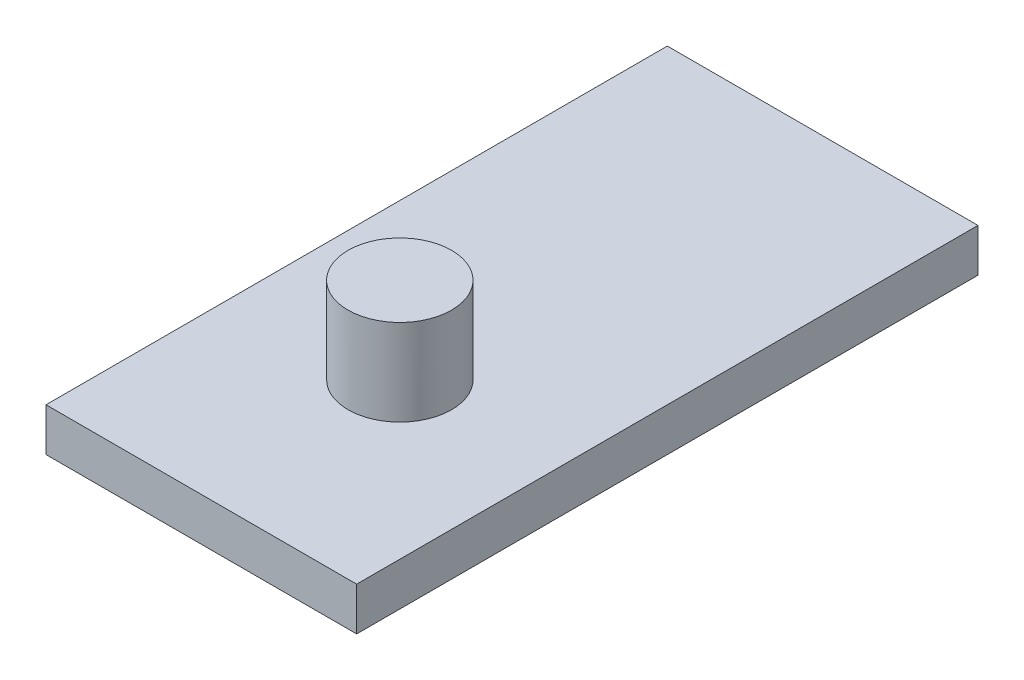
from build123d import *

# Parameters (mm, degrees)
SKETCH1_W           = 36
SKETCH1_H           = 72
BOSS_EXTRUDE1_DEPTH = 5
SKETCH2_R           = 6
BOSS_EXTRUDE2_DEPTH = 10


with BuildPart() as part:
    # Sketch1 → Boss-Extrude1 (new body)
    with BuildSketch(Plane(origin=(0, 0, 0), x_dir=(1, 0, 0), z_dir=(0, 1, 0))):
        Rectangle(SKETCH1_W, SKETCH1_H)
    extrude(amount=BOSS_EXTRUDE1_DEPTH)

    # Sketch2 → Boss-Extrude2 (add)
    with BuildSketch(Plane(origin=(0, 5, 0), x_dir=(1, 0, 0), z_dir=(0, 1, 0))):
        with Locations(Location((0, -13, 0), (0, 0, 90))):
            Circle(SKETCH2_R)
    extrude(amount=BOSS_EXTRUDE2_DEPTH)


solid = part.part
